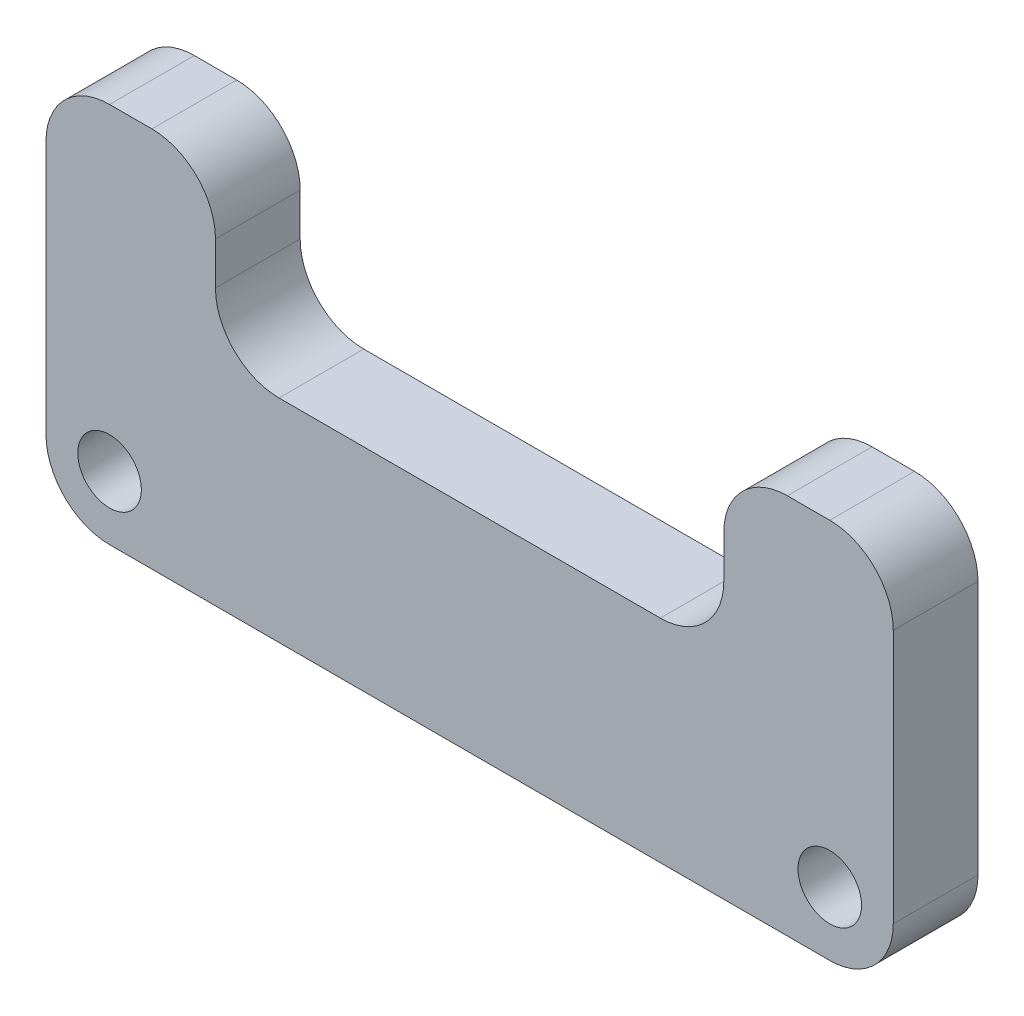
from build123d import *

# Parameters (mm, degrees)
SKETCH1_R           = 7.5
BOSS_EXTRUDE1_DEPTH = 20


with BuildPart() as part:
    # Sketch1 → Boss-Extrude1 (new body)
    with BuildSketch(Plane.XY):
        with BuildLine():
            Line((-85, 0), (85, 0))
            ThreePointArc((85, 0), (95.606601718, 4.393398282), (100, 15))
            Line((100, 15), (100, 75))
            ThreePointArc((100, 75), (95.606601718, 85.606601718), (85, 90))
            Line((85, 90), (75, 90))
            ThreePointArc((75, 90), (64.393398282, 85.606601718), (60, 75))
            Line((60, 75), (60, 65))
            ThreePointArc((60, 65), (55.606601718, 54.393398282), (45, 50))
            Line((45, 50), (-45, 50))
            ThreePointArc((-45, 50), (-55.606601718, 54.393398282), (-60, 65))
            Line((-60, 65), (-60, 75))
            ThreePointArc((-60, 75), (-64.393398282, 85.606601718), (-75, 90))
            Line((-75, 90), (-85, 90))
            ThreePointArc((-85, 90), (-95.606601718, 85.606601718), (-100, 75))
            Line((-100, 75), (-100, 15))
            ThreePointArc((-100, 15), (-95.606601718, 4.393398282), (-85, 0))
        make_face()
        with Locations((85, 15)):
            Circle(SKETCH1_R, mode=Mode.SUBTRACT)
        with Locations(Location((-85, 15, 0), (0, 0, 180))):
            Circle(SKETCH1_R, mode=Mode.SUBTRACT)
    extrude(amount=BOSS_EXTRUDE1_DEPTH)


solid = part.part
